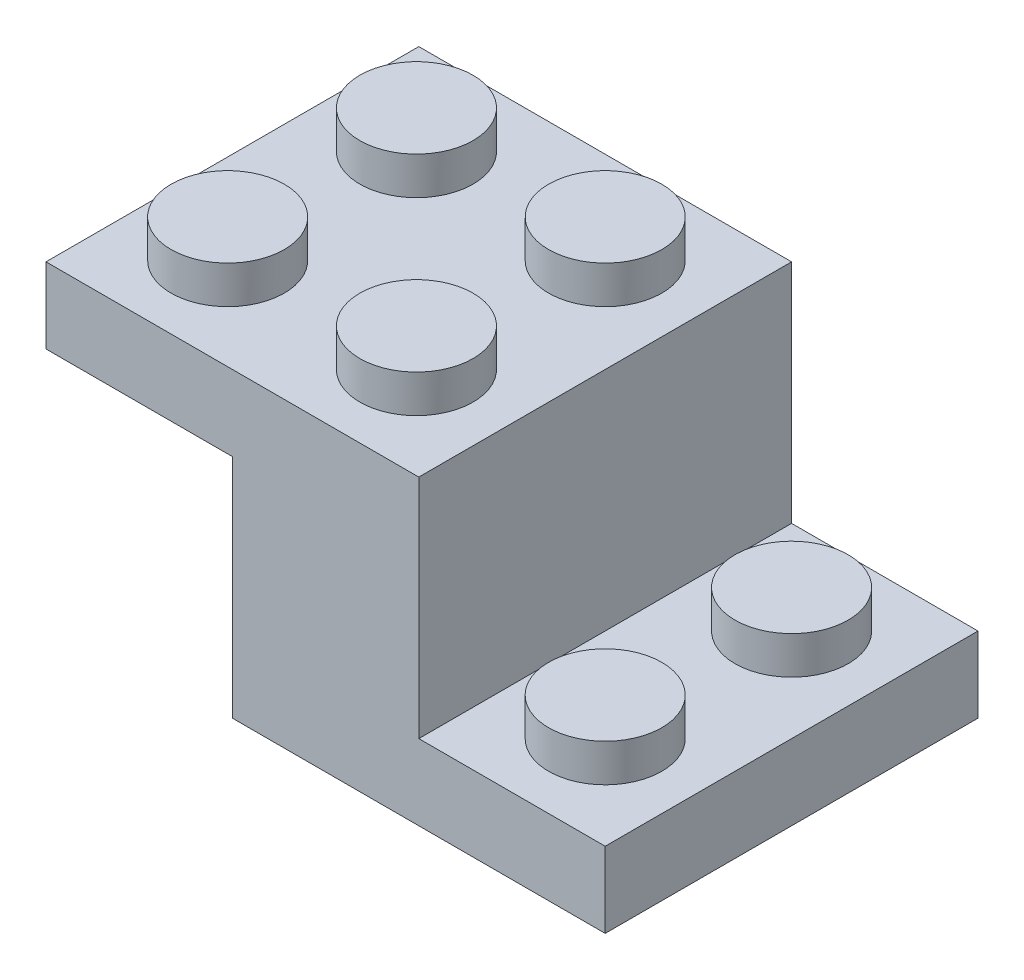
from build123d import *

# Parameters (mm, degrees)
MAINBASESKETCH_W                = 7.9
MAINBASESKETCH_H                = 12.8
MAINBASEEXTRUDE_DEPTH           = 7.9
STUDSSKETCH_R                   = 2.4
STUDSEXTRUDE_DEPTH              = 1.6
STUDSPATTERN_COUNT              = 2
STUDSPATTERN_PITCH              = 8
MAINBASESHELL_T                 = -1.2
SLIMYELLOWUNDEREXT_START        = -0.2
SLIMYELLOWUNDEREXT_DEPTH        = 11.6
ZIGZAGSKETCH_W                  = 7.9
ZIGZAGSKETCH_H                  = 3.2
ZIGZAGBLUEEXT_DEPTH             = 15.8
LPATTERN1_COUNT                 = 2
LPATTERN1_PITCH                 = 8
LPATTERN1_COPY_1_SKETCH_R       = 2.4
LPATTERN1_COPY_1_DEPTH          = 1.6
ZIGZAGSTUDSKETCH_R              = 2.4
ADDEDSTUDSZIGZAG_DEPTH          = 1.6
CUTUSEDASSHELLSKETCH_W          = 6.71130504
CUTUSEDASSHELLSKETCH_H          = 13.400349982
CUTUSEDASSHELL_DEPTH            = 2.4
ZIGZAGUNDERSTUDSSKETCH_R        = 1.2
ZIGZAGUNDERSTUDHOLES_DEPTH      = 1.7
ZIGZAGUNDERSEMICIRCLEEXT_START  = -0.2
ZIGZAGUNDERSEMICIRCLEEXT_DEPTH  = 1.6
CUTUSEDASSHELLSKETCH2_W         = 6.7
CUTUSEDASSHELLSKETCH2_H         = 13.4
CUTUSEDASSHELL2_DEPTH           = 2.4
ZIGZAGUNDERSEMICEXT2_START      = -0.2
ZIGZAGUNDERSEMICEXT2_DEPTH      = 1.6
ZIGZAGINSIDECORNER1_R           = 1
ZIGZAGINSIDECORNER2_R           = 1
ZIGZAGUNDERSTUDSKETCH2_R        = 1.2
CUT_EXTRUDE1_DEPTH              = 1.7
RECTANGULARUNDEREXTRUDES1_START = -0.2
RECTANGULAREXTSKETCH_W          = 1.100347559
RECTANGULAREXTSKETCH_H          = 0.995198726
RECTANGULARUNDEREXTRUDES1_DEPTH = 1.5
RECTANGULARUNDEREXTRUDES2_START = -0.2
RECTANGULARUNDEREXTSKETCH2_W    = 1.105292793
RECTANGULARUNDEREXTSKETCH2_H    = 0.995198726
RECTANGULARUNDEREXTRUDES2_DEPTH = 1.5


with BuildPart() as part:
    # MainBaseSketch → MainBaseExtrude (new, symmetric)
    with BuildSketch(Plane.XY):
        with Locations((4.631967213, 6.4)):
            Rectangle(MAINBASESKETCH_W, MAINBASESKETCH_H)
    extrude(amount=MAINBASEEXTRUDE_DEPTH, both=True)

    # StudsSketch → StudsExtrude (add)
    with BuildSketch(Plane(origin=(0, 12.8, 0), x_dir=(1, 0, 0), z_dir=(0, 1, 0))):
        with Locations(Location((4.581967213, 4, 0), (0, 0, 90))):
            Circle(STUDSSKETCH_R)
    studsextrude = extrude(amount=STUDSEXTRUDE_DEPTH)

    # StudsPattern: StudsExtrude ×2
    with Locations(*[(0, 0, i * STUDSPATTERN_PITCH) for i in range(1, STUDSPATTERN_COUNT)]):
        add(studsextrude)

    # MainBaseShell
    mainbaseshell_openings = [part.faces().sort_by_distance(p)[0] for p in [
        (4.631967213, 0, 0),
    ]]
    offset(amount=MAINBASESHELL_T, openings=mainbaseshell_openings, kind=Kind.INTERSECTION)

    # SlimYellowUnderExtSketch → SlimYellowUnderExt (add)
    with BuildSketch(Plane.XZ.offset(-11.6).offset(SLIMYELLOWUNDEREXT_START)):
        Polygon((1.881967213, 1.952811318), (1.881967213, 2.947188682), (2.384104441, 2.947188682), (2.882626102, 2.45), (2.384104441, 1.952811318), align=None)
        Polygon((6.381308324, 2.45), (6.879829986, 2.947188682), (7.381967213, 2.947188682), (7.381967213, 1.952811318), (6.879829986, 1.952811318), align=None)
        Polygon((1.881967213, -1.952811318), (2.384104441, -1.952811318), (2.882626102, -2.45), (2.384104441, -2.947188682), (1.881967213, -2.947188682), align=None)
        Polygon((7.381967213, -1.952811318), (7.381967213, -2.947188682), (6.879829986, -2.947188682), (6.381308324, -2.45), (6.879829986, -1.952811318), align=None)
    extrude(amount=SLIMYELLOWUNDEREXT_DEPTH)

    # ZigZagSketch → ZIGZAGBlueExt (add)
    with BuildSketch(Plane.XY.offset(7.9)):
        with Locations((-3.268032787, 11.2)):
            Rectangle(ZIGZAGSKETCH_W, ZIGZAGSKETCH_H)
        with Locations((12.531967213, 1.6)):
            Rectangle(ZIGZAGSKETCH_W, ZIGZAGSKETCH_H)
    extrude(amount=-ZIGZAGBLUEEXT_DEPTH)

    # LPattern1: StudsExtrude ×2
    with Locations(*[(-i * LPATTERN1_PITCH, 0, 0) for i in range(1, LPATTERN1_COUNT)]):
        add(studsextrude)

    # LPattern1 copy 1 sketch → LPattern1 copy 1 (add)
    with BuildSketch(Plane(origin=(-8, 12.8, 8), x_dir=(1, 0, 0), z_dir=(0, 1, 0))):
        with Locations(Location((4.581967213, 4, 0), (0, 0, 90))):
            Circle(LPATTERN1_COPY_1_SKETCH_R)
    extrude(amount=LPATTERN1_COPY_1_DEPTH)

    # ZigZagStudSketch → AddedStudsZigZag (add)
    with BuildSketch(Plane(origin=(0, 3.2, 0), x_dir=(1, 0, 0), z_dir=(0, 1, 0))):
        with Locations(Location((12.531967213, 3.95, 0), (0, 0, 270))):
            Circle(ZIGZAGSTUDSKETCH_R)
        with Locations(Location((12.531967213, -3.95, 0), (0, 0, 90))):
            Circle(ZIGZAGSTUDSKETCH_R)
    extrude(amount=ADDEDSTUDSZIGZAG_DEPTH)

    # CutUsedAsShellSketch → CutUsedasShell (cut)
    with BuildSketch(Plane.XZ):
        with Locations((11.948290767, 0)):
            Rectangle(CUTUSEDASSHELLSKETCH_W, CUTUSEDASSHELLSKETCH_H)
    extrude(amount=-CUTUSEDASSHELL_DEPTH, mode=Mode.SUBTRACT)

    # ZigZagUnderStudsSketch → ZigZagUnderStudHoles (cut)
    with BuildSketch(Plane.XZ.offset(-2.4)):
        with Locations(Location((13.103943287, 4, 0), (0, 0, 270))):
            Circle(ZIGZAGUNDERSTUDSSKETCH_R)
        with Locations(Location((13.103943287, -4, 0), (0, 0, 90))):
            Circle(ZIGZAGUNDERSTUDSSKETCH_R)
    extrude(amount=-ZIGZAGUNDERSTUDHOLES_DEPTH, mode=Mode.SUBTRACT)

    # ZigZAgUNderSemiCSketch → ZigZagUnderSemiCircleExt (add)
    with BuildSketch(Plane.XZ.offset(-2.4).offset(ZIGZAGUNDERSEMICIRCLEEXT_START)):
        with BuildLine():
            ThreePointArc((8.592638247, -3.25057639), (11.595624855, -0.104008885), (8.592638247, 3.04255862))
            Line((8.592638247, 3.04255862), (8.592638247, 2.4))
            ThreePointArc((8.592638247, 2.4), (10.992638247, 0), (8.592638247, -2.4))
            Line((8.592638247, -2.4), (8.592638247, -2.40057639))
            Line((8.592638247, -2.40057639), (8.592638247, -3.25057639))
        make_face()
    extrude(amount=ZIGZAGUNDERSEMICIRCLEEXT_DEPTH)

    # CutUsedAsShellSketch2 → CutUsedAsShell2 (cut)
    with BuildSketch(Plane.XZ.offset(-9.6)):
        with Locations((-2.668032787, 0)):
            Rectangle(CUTUSEDASSHELLSKETCH2_W, CUTUSEDASSHELLSKETCH2_H)
    extrude(amount=-CUTUSEDASSHELL2_DEPTH, mode=Mode.SUBTRACT)

    # ZigZagUnderSemiCExtSketch → ZigZagUnderSemiCExt2 (add)
    with BuildSketch(Plane.XZ.offset(-12).offset(ZIGZAGUNDERSEMICEXT2_START)):
        with BuildLine():
            Line((0.681967213, -3.12), (0.681967213, -2.45))
            ThreePointArc((0.681967213, -2.45), (-1.768032787, 0), (0.681967213, 2.45))
            Line((0.681967213, 2.45), (0.681967213, 3.12))
            ThreePointArc((0.681967213, 3.12), (-2.438032787, 0), (0.681967213, -3.12))
        make_face()
    extrude(amount=ZIGZAGUNDERSEMICEXT2_DEPTH)

    # ZigZagInsideCorner1
    zigzaginsidecorner1_edges = [part.edges().sort_by_distance(p)[0] for p in [
        (8.592638247, 1.2, -6.700174991),
        (8.592638247, 1.2, 6.700174991),
    ]]
    fillet(zigzaginsidecorner1_edges, radius=ZIGZAGINSIDECORNER1_R)

    # ZigZagInsideCorner2
    zigzaginsidecorner2_edges = [part.edges().sort_by_distance(p)[0] for p in [
        (0.681967213, 10.8, -6.7),
        (0.681967213, 10.8, 6.7),
    ]]
    fillet(zigzaginsidecorner2_edges, radius=ZIGZAGINSIDECORNER2_R)

    # ZigZagUnderStudSketch2 → Cut-Extrude1 (cut)
    with BuildSketch(Plane.XZ.offset(-12)):
        with Locations((-3.818032787, 4)):
            Circle(ZIGZAGUNDERSTUDSKETCH2_R)
        with Locations((-3.818032787, -4)):
            Circle(ZIGZAGUNDERSTUDSKETCH2_R)
    extrude(amount=-CUT_EXTRUDE1_DEPTH, mode=Mode.SUBTRACT)

    # RectangularExtSketch → RectangularUnderExtrudes1 (add)
    with BuildSketch(Plane.XZ.offset(-12).offset(RECTANGULARUNDEREXTRUDES1_START)):
        with Locations((0.131793434, 4.747212315)):
            Rectangle(RECTANGULAREXTSKETCH_W, RECTANGULAREXTSKETCH_H)
        with Locations((0.131793434, -4.747212315)):
            Rectangle(RECTANGULAREXTSKETCH_W, RECTANGULAREXTSKETCH_H)
    extrude(amount=RECTANGULARUNDEREXTRUDES1_DEPTH)

    # RectangularUnderExtSketch2 → RectangularUnderExtrudes2 (add)
    with BuildSketch(Plane.XZ.offset(-2.4).offset(RECTANGULARUNDEREXTRUDES2_START)):
        with Locations((9.153257665, 4.747212315)):
            Rectangle(RECTANGULARUNDEREXTSKETCH2_W, RECTANGULARUNDEREXTSKETCH2_H)
        with Locations((9.153257665, -4.747212315)):
            Rectangle(RECTANGULARUNDEREXTSKETCH2_W, RECTANGULARUNDEREXTSKETCH2_H)
    extrude(amount=RECTANGULARUNDEREXTRUDES2_DEPTH)


solid = part.part
